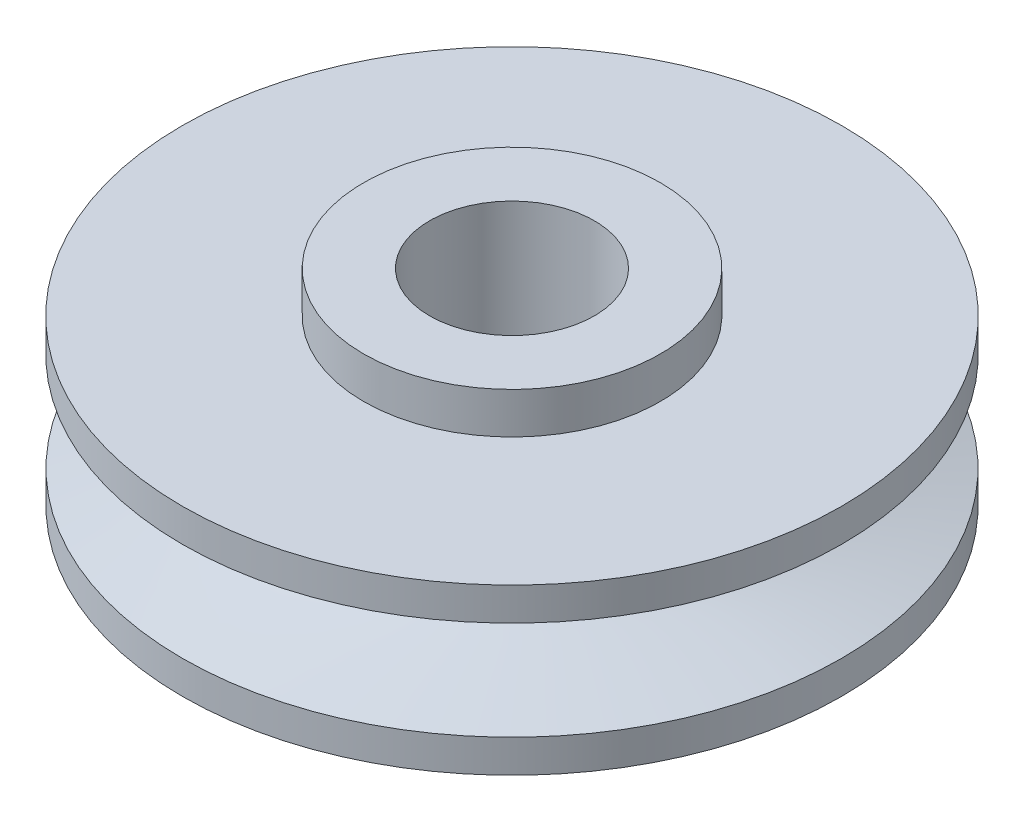
from build123d import *


with BuildPart() as part:
    # 草图1 → 旋转9 (revolve)
    with BuildSketch(Plane.XY, mode=Mode.PRIVATE) as revolve_9_sk:
        with BuildLine():
            Line((1, -1.5), (1.8, -1.5))
            Line((1.8, -1.5), (1.8, -1))
            Line((1.8, -1), (3.997858661, -1))
            Line((3.997858661, -1), (3.997858661, -0.6))
            add(Edge.make_bspline(
                [(4, 0.6), (2.168643652, 0), (3.997858661, -0.6)],
                knots=[0, 0, 0, 1, 1, 1], degree=2, weights=[1, 2.678143978, 1]))
            Line((4, 0.6), (4, 1))
            Line((4, 1), (1.8, 1))
            Line((1.8, 1), (1.8, 1.5))
            Line((1.8, 1.5), (1, 1.5))
            Line((1, 1.5), (1, -1.5))
        make_face()
    revolve(revolve_9_sk.sketch.rotate(Axis((0, 2.07863921, 0), (0, -1, 0)), 90), axis=Axis((0, 2.07863921, 0), (0, -1, 0)))


solid = part.part
